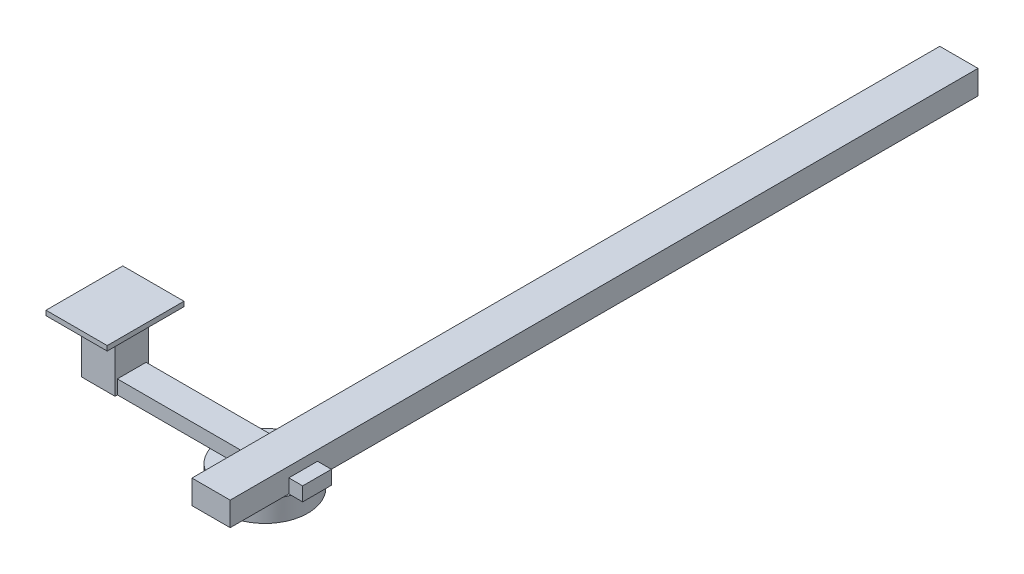
from build123d import *

# Parameters (mm, degrees)
ESQUISSE1_W        = 90
ESQUISSE1_H        = 45
ESQUISSE2_W        = 79.950738566
ESQUISSE2_H        = 1563.706247811
BOSS_EXTRU_1_DEPTH = 50
BOSS_EXTRU_2_DEPTH = 29
ESQUISSE5_W        = 60
ESQUISSE5_H        = 29
BOSS_EXTRU_3_DEPTH = 29
BOSS_EXTRU_4_DEPTH = 90
ESQUISSE9_W        = 128
ESQUISSE9_H        = 160.5
BOSS_EXTRU_5_DEPTH = 10


with BuildPart() as part:
    # Esquisse1 → Révolution1 (revolve)
    with BuildSketch(Plane.XY, mode=Mode.PRIVATE) as r_volution1_sk:
        with Locations((45, 22.5)):
            Rectangle(ESQUISSE1_W, ESQUISSE1_H)
    revolve(r_volution1_sk.sketch.rotate(Axis((0, 45, 0), (0, -1, 0)), 180), axis=Axis((0, 45, 0), (0, -1, 0)))

    # Esquisse2 → Boss.-Extru.1 (add)
    with BuildSketch(Plane(origin=(0, 45, 0), x_dir=(1, 0, 0), z_dir=(0, 1, 0))):
        with Locations((39.975369283, 629.271080586)):
            Rectangle(ESQUISSE2_W, ESQUISSE2_H)
    extrude(amount=BOSS_EXTRU_1_DEPTH)

    # Esquisse3 → Boss.-Extru.2 (add)
    with BuildSketch(Plane(origin=(0, 45, 0), x_dir=(1, 0, 0), z_dir=(0, 1, 0))):
        Polygon((-278.5, 30), (0, 30), (0, -30), (-278.5, -30), (-278.5, -35), (-348.5, -35), (-348.5, -30), (-348.5, 30), (-348.5, 35), (-278.5, 35), align=None)
    extrude(amount=BOSS_EXTRU_2_DEPTH)

    # Esquisse5 → Boss.-Extru.3 (add)
    with BuildSketch(Plane(origin=(79.950738566, 0, 0), x_dir=(0, 0, -1), z_dir=(1, 0, 0))):
        with Locations((0, 59.5)):
            Rectangle(ESQUISSE5_W, ESQUISSE5_H)
    extrude(amount=BOSS_EXTRU_3_DEPTH)

    # Esquisse6 → Boss.-Extru.4 (add)
    with BuildSketch(Plane(origin=(0, 74, 0), x_dir=(1, 0, 0), z_dir=(0, 1, 0))):
        Polygon((-348.5, 35), (-278.5, 35), (-278.5, -30), (-278.5, -35), (-348.5, -35), (-348.5, -30), align=None)
    extrude(amount=BOSS_EXTRU_4_DEPTH)

    # Esquisse9 → Boss.-Extru.5 (add)
    with BuildSketch(Plane(origin=(0, 164, 0), x_dir=(1, 0, 0), z_dir=(0, 1, 0))):
        with Locations((-313.5, 0)):
            Rectangle(ESQUISSE9_W, ESQUISSE9_H)
    extrude(amount=BOSS_EXTRU_5_DEPTH)


solid = part.part
